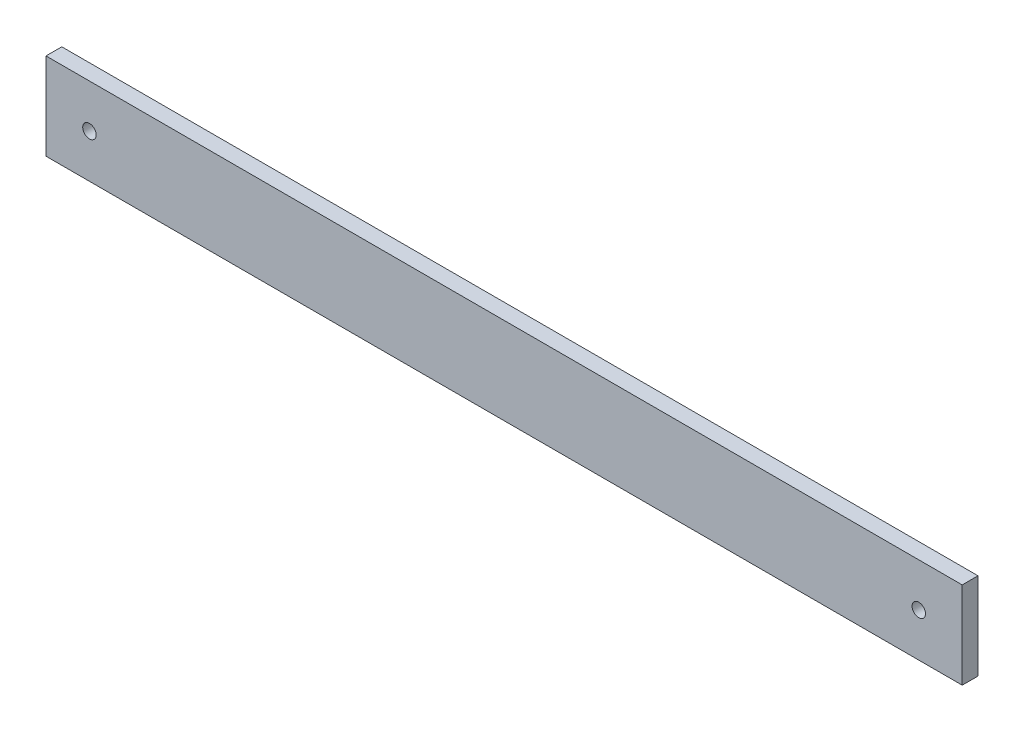
from build123d import *

# Parameters (mm, degrees)
SKETCH_1_W      = 232
SKETCH_1_H      = 22
SKETCH_1_R      = 1.7
EXTRUDE_1_DEPTH = 2


with BuildPart() as part:
    # 草图1 → 凸台-拉伸1 (new, symmetric)
    with BuildSketch(Plane.XY):
        with Locations((105, 0)):
            Rectangle(SKETCH_1_W, SKETCH_1_H)
        Circle(SKETCH_1_R, mode=Mode.SUBTRACT)
        with Locations((210, 0)):
            Circle(SKETCH_1_R, mode=Mode.SUBTRACT)
    extrude(amount=EXTRUDE_1_DEPTH, both=True)


solid = part.part
